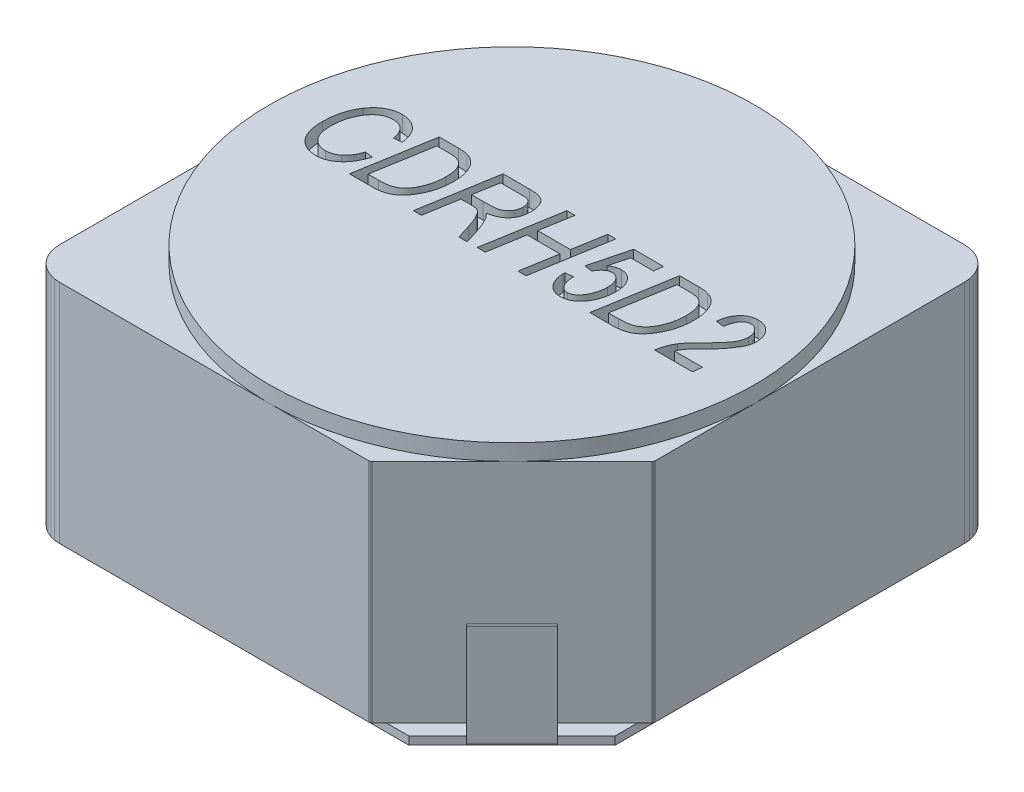
from build123d import *

# Parameters (mm, degrees)
EXTRUDE_1_DEPTH     = 0.1
EXTRUDE_1_2_DEPTH   = 0.1
EXTRUDE_2_DEPTH     = 2.8
EXTRUDE_3_DEPTH     = 1.2
FILLET_1_R          = 0.05
FILLET_2_R          = 0.05
SKETCH_5_R          = 3.000627
EXTRUDE_4_DEPTH     = 0.2
CUT_EXTRUDE_1_DEPTH = 0.2


with BuildPart() as part:
    # Эскиз2 → Бобышка-Вытянуть1 (new body)
    with BuildSketch(Plane(origin=(0, 0, 0), x_dir=(1, 0, 0), z_dir=(0, 1, 0))):
        Polygon((0.454807, -1.018854), (0.443746, -1.007793), (0.432957, -0.997004), (0.998007, -0.431953), (1.008796, -0.442742), (1.019858, -0.453804), (1.373411, -0.10025), (4.901254, -0.10025), (5.901254, -1.100251), (5.901254, -2.00025), (5.072486, -2.00025), (4.940356, -1.763366), (4.781258, -1.543684), (4.597404, -1.344259), (4.39135, -1.167866), (4.165964, -1.016958), (3.924379, -0.893632), (3.669955, -0.799606), (3.406231, -0.736185), (3.136875, -0.704253), (2.865633, -0.704253), (2.596277, -0.736185), (2.332552, -0.799606), (2.078129, -0.893632), (1.836544, -1.016958), (1.611158, -1.167866), (1.405104, -1.344259), (1.22125, -1.543684), (1.062152, -1.763366), (0.930023, -2.00025), (0.101254, -2.00025), (0.101254, -1.372408), align=None)
    extrude(amount=EXTRUDE_1_DEPTH)



with BuildPart() as body_2:
    # Эскиз2 → Extrude 1 2 (new body)
    with BuildSketch(Plane(origin=(0, 0, 0), x_dir=(1, 0, 0), z_dir=(0, 1, 0))):
        Polygon((1.611158, -4.832635), (1.836544, -4.983543), (2.078129, -5.106869), (2.332552, -5.200896), (2.596277, -5.264316), (2.865633, -5.296248), (3.136875, -5.296248), (3.406231, -5.264316), (3.669955, -5.200896), (3.924379, -5.106869), (4.165964, -4.983543), (4.39135, -4.832635), (4.597404, -4.656241), (4.781258, -4.456817), (4.940356, -4.237135), (5.072486, -4.00025), (5.901254, -4.00025), (5.901254, -4.628093), (5.5477, -4.981646), (5.558762, -4.992708), (5.569552, -5.003497), (5.004501, -5.568548), (4.993712, -5.557759), (4.98265, -5.546697), (4.629097, -5.90025), (1.101254, -5.90025), (0.101254, -4.900251), (0.101254, -4.00025), (0.930023, -4.00025), (1.062152, -4.237135), (1.22125, -4.456817), (1.405104, -4.656241), align=None)
    extrude(amount=EXTRUDE_1_2_DEPTH)


with BuildPart() as part_1:
    add(part.part)

    add(body_2.part)  # Бобышка-Вытянуть2 merges body 2
    # Эскиз3 → Бобышка-Вытянуть2 (add)
    with BuildSketch(Plane(origin=(0, 0.1, 0), x_dir=(1, 0, 0), z_dir=(0, 1, 0))):
        Polygon((0.101254, -1.655251), (1.656254, -0.10025), (1.741609, -0.014895), (1.747575, -0.0098), (1.754265, -0.0057), (1.761514, -0.002698), (1.769143, -0.000866), (1.776965, -0.000251), (5.601254, -0.000251), (5.663828, -0.005175), (5.724861, -0.019828), (5.78285, -0.043848), (5.836368, -0.076644), (5.884097, -0.117408), (5.924861, -0.165137), (5.957657, -0.218655), (5.981677, -0.276644), (5.996329, -0.337677), (6.001254, -0.400251), (6.001254, -4.22454), (6.000638, -4.232362), (5.998807, -4.239991), (5.995804, -4.24724), (5.991705, -4.253929), (5.986609, -4.259896), (5.901254, -4.345251), (4.346254, -5.90025), (4.260899, -5.985606), (4.254933, -5.990701), (4.248243, -5.994801), (4.240994, -5.997803), (4.233365, -5.999635), (4.225543, -6.000251), (0.401254, -6.000251), (0.33868, -5.995326), (0.277647, -5.980673), (0.219658, -5.956653), (0.16614, -5.923857), (0.118411, -5.883093), (0.077647, -5.835365), (0.044851, -5.781847), (0.020831, -5.723857), (0.006179, -5.662824), (0.001254, -5.600251), (0.001254, -1.775961), (0.00187, -1.76814), (0.003701, -1.76051), (0.006704, -1.753262), (0.010803, -1.746572), (0.015899, -1.740606), align=None)
    extrude(amount=EXTRUDE_2_DEPTH)

    # Эскиз4 → Бобышка-Вытянуть3 (add)
    with BuildSketch(Plane(origin=(0, 0.1, 0), x_dir=(1, 0, 0), z_dir=(0, 1, 0))):
        Polygon((0.454807, -1.018854), (1.019858, -0.453804), (0.998007, -0.431953), (0.432957, -0.997004), align=None)
        Polygon((4.98265, -5.546697), (5.5477, -4.981646), (5.569552, -5.003497), (5.004501, -5.568548), align=None)
    extrude(amount=EXTRUDE_3_DEPTH)

    # Скругление1
    fillet_1_edges = [part_1.edges().sort_by_distance(p)[0] for p in [
        (5.287026, 0, 5.286023),
    ]]
    fillet(fillet_1_edges, radius=FILLET_1_R)

    # Скругление2
    fillet_2_edges = [part_1.edges().sort_by_distance(p)[0] for p in [
        (0.715482, 0, 0.714478),
    ]]
    fillet(fillet_2_edges, radius=FILLET_2_R)

    # Эскиз5 → Бобышка-Вытянуть4 (add)
    with BuildSketch(Plane(origin=(0, 2.9, 0), x_dir=(1, 0, 0), z_dir=(0, 1, 0))):
        with Locations(Location((3.000627, -3.000126, 0), (0, 0, 88.717191))):
            Circle(SKETCH_5_R)
    extrude(amount=EXTRUDE_4_DEPTH)

    # Эскиз6 → Вырез-Вытянуть1 (cut)
    # profile 1 of 7: a face of its own
    with BuildSketch(Plane(origin=(0, 3.1, 0), x_dir=(1, 0, 0), z_dir=(0, 1, 0))):
        with BuildLine():
            Line((1.099199, -2.911531), (1.197901, -2.923868))
            add(Edge.make_bspline(
                [(1.197901, -2.923868), (1.193486, -2.937415), (1.18487, -2.963852), (1.16975, -3.001772), (1.153248, -3.037107), (1.13513, -3.069799), (1.115402, -3.099824), (1.094217, -3.127235), (1.071566, -3.15211), (1.047492, -3.174202), (1.022421, -3.193764), (0.996516, -3.210468), (0.970263, -3.224951), (0.943212, -3.23648), (0.915762, -3.245901), (0.887498, -3.252179), (0.858794, -3.256174), (0.839415, -3.256714), (0.829698, -3.256985)],
                knots=[0, 0, 0, 0, 1.281228, 2.500455, 3.669111, 4.786805, 5.85923, 6.897388, 7.899677, 8.881374, 9.832849, 10.756243, 11.651107, 12.526133, 13.397948, 14.257432, 15.12633, 16, 16, 16, 16], degree=3))
            add(Edge.make_bspline(
                [(0.829698, -3.256985), (0.817922, -3.256717), (0.794844, -3.256191), (0.761113, -3.251244), (0.729179, -3.243204), (0.698982, -3.231831), (0.670337, -3.217667), (0.643529, -3.199918), (0.618618, -3.178925), (0.595329, -3.155015), (0.574536, -3.127749), (0.556343, -3.097423), (0.540753, -3.064087), (0.528755, -3.027484), (0.518703, -2.98811), (0.51203, -2.945578), (0.507647, -2.900057), (0.507214, -2.868681), (0.506992, -2.852541)],
                knots=[0, 0, 0, 0, 0.965468, 1.891996, 2.789402, 3.661691, 4.533837, 5.405106, 6.291862, 7.201367, 8.137501, 9.097472, 10.097304, 11.149039, 12.252251, 13.427238, 14.676528, 16, 16, 16, 16], degree=3))
            add(Edge.make_bspline(
                [(0.506992, -2.852541), (0.507305, -2.833443), (0.507921, -2.795945), (0.51334, -2.740901), (0.521612, -2.688022), (0.53387, -2.637485), (0.549225, -2.589025), (0.568242, -2.542938), (0.590193, -2.498772), (0.607994, -2.471394), (0.616874, -2.457736)],
                knots=[0, 0, 0, 0, 1.101519, 2.162778, 3.187881, 4.186831, 5.159905, 6.117497, 7.06084, 8, 8, 8, 8], degree=3))
            add(Edge.make_bspline(
                [(0.616874, -2.457736), (0.621892, -2.450625), (0.631765, -2.436634), (0.647396, -2.41664), (0.663814, -2.398229), (0.680578, -2.380955), (0.697974, -2.365138), (0.715851, -2.3506), (0.73452, -2.337707), (0.753484, -2.325906), (0.773135, -2.315597), (0.79333, -2.306799), (0.814046, -2.299216), (0.835302, -2.29304), (0.857074, -2.28826), (0.879398, -2.284689), (0.90228, -2.282858), (0.91773, -2.282494), (0.925508, -2.28231)],
                knots=[0, 0, 0, 0, 1.12653, 2.216505, 3.28309, 4.318368, 5.331145, 6.324957, 7.298759, 8.266038, 9.214828, 10.168383, 11.115713, 12.06865, 13.03134, 13.999584, 14.992943, 16, 16, 16, 16], degree=3))
            add(Edge.make_bspline(
                [(0.925508, -2.28231), (0.935415, -2.282512), (0.954914, -2.282911), (0.983515, -2.286643), (1.010858, -2.29285), (1.036946, -2.301326), (1.061895, -2.31214), (1.085401, -2.325722), (1.107678, -2.341668), (1.128735, -2.359716), (1.147968, -2.380151), (1.165207, -2.40263), (1.180336, -2.427095), (1.193233, -2.453513), (1.203813, -2.481966), (1.212553, -2.512285), (1.218866, -2.544684), (1.221322, -2.567018), (1.222576, -2.578414)],
                knots=[0, 0, 0, 0, 1.020223, 2.007994, 2.965122, 3.905064, 4.829944, 5.761056, 6.696043, 7.648858, 8.613533, 9.581407, 10.562389, 11.571947, 12.604742, 13.6859, 14.819279, 16, 16, 16, 16], degree=3))
            Line((1.222576, -2.578414), (1.123875, -2.590752))
            add(Edge.make_bspline(
                [(1.123875, -2.590752), (1.122505, -2.582761), (1.119837, -2.567195), (1.114138, -2.544828), (1.107694, -2.523902), (1.099938, -2.504603), (1.09129, -2.486789), (1.081633, -2.470526), (1.071019, -2.455732), (1.059202, -2.442534), (1.046235, -2.430947), (1.032285, -2.42086), (1.017313, -2.412281), (1.001257, -2.405372), (0.984207, -2.399957), (0.966132, -2.396115), (0.947033, -2.39377), (0.933933, -2.393491), (0.927243, -2.393349)],
                knots=[0, 0, 0, 0, 1.260258, 2.455112, 3.586565, 4.662836, 5.68627, 6.663126, 7.600598, 8.513462, 9.412214, 10.299729, 11.18595, 12.09002, 13.012838, 13.963427, 14.959968, 16, 16, 16, 16], degree=3))
            add(Edge.make_bspline(
                [(0.927243, -2.393349), (0.91552, -2.393746), (0.892474, -2.394527), (0.858763, -2.401013), (0.8269, -2.412018), (0.79651, -2.426815), (0.768191, -2.446512), (0.741439, -2.470106), (0.71672, -2.498257), (0.69386, -2.530025), (0.673254, -2.564743), (0.655118, -2.601341), (0.63983, -2.63958), (0.627267, -2.679323), (0.61768, -2.720723), (0.61078, -2.76368), (0.606395, -2.808176), (0.605929, -2.838394), (0.605693, -2.853698)],
                knots=[0, 0, 0, 0, 0.903137, 1.775501, 2.633887, 3.495597, 4.372141, 5.284508, 6.238829, 7.253412, 8.297421, 9.347418, 10.398745, 11.468705, 12.55725, 13.671237, 14.820616, 16, 16, 16, 16], degree=3))
            add(Edge.make_bspline(
                [(0.605693, -2.853698), (0.605853, -2.8654), (0.606164, -2.888141), (0.609281, -2.921195), (0.614427, -2.951995), (0.621497, -2.98061), (0.630802, -3.006915), (0.641898, -3.031174), (0.655253, -3.053141), (0.670735, -3.072637), (0.68781, -3.089716), (0.705671, -3.104989), (0.725015, -3.11752), (0.745215, -3.128064), (0.766703, -3.135939), (0.789156, -3.141767), (0.812751, -3.145302), (0.828851, -3.145729), (0.837024, -3.145946)],
                knots=[0, 0, 0, 0, 1.335276, 2.594853, 3.78487, 4.896581, 5.954293, 6.964911, 7.935927, 8.880865, 9.798777, 10.688964, 11.55753, 12.42346, 13.284406, 14.16313, 15.067554, 16, 16, 16, 16], degree=3))
            add(Edge.make_bspline(
                [(0.837024, -3.145946), (0.844103, -3.145841), (0.858059, -3.145632), (0.878602, -3.142702), (0.898566, -3.138578), (0.917811, -3.132511), (0.936513, -3.125092), (0.954226, -3.115429), (0.971563, -3.104518), (0.982325, -3.095931), (0.987775, -3.091584)],
                knots=[0, 0, 0, 0, 1.037246, 2.044789, 3.03728, 4.023849, 5.000285, 5.982523, 6.978454, 8, 8, 8, 8], degree=3))
            add(Edge.make_bspline(
                [(0.987775, -3.091584), (0.994228, -3.085832), (1.007131, -3.07433), (1.024843, -3.055356), (1.041149, -3.035038), (1.055842, -3.013171), (1.068889, -2.989756), (1.08068, -2.965062), (1.091016, -2.938931), (1.096442, -2.920765), (1.099199, -2.911531)],
                knots=[0, 0, 0, 0, 0.964744, 1.929115, 2.893833, 3.87085, 4.866654, 5.883935, 6.924454, 8, 8, 8, 8], degree=3))
        make_face()
    # profile 2 of 7: a face of its own
    with BuildSketch(Plane(origin=(0, 3.1, 0), x_dir=(1, 0, 0), z_dir=(0, 1, 0))):
        with BuildLine():
            Line((1.234914, -3.244648), (1.395496, -2.294648))
            Line((1.395496, -2.294648), (1.632225, -2.294648))
            add(Edge.make_bspline(
                [(1.632225, -2.294648), (1.644697, -2.29477), (1.668122, -2.295), (1.700872, -2.29732), (1.728993, -2.300773), (1.745799, -2.305036), (1.753481, -2.306985)],
                knots=[0, 0, 0, 0, 1.224118, 2.29924, 3.22264, 4, 4, 4, 4], degree=3))
            add(Edge.make_bspline(
                [(1.753481, -2.306985), (1.763552, -2.310241), (1.783674, -2.316747), (1.812001, -2.331573), (1.838619, -2.350024), (1.86333, -2.372331), (1.886079, -2.398349), (1.90625, -2.42839), (1.923087, -2.46276), (1.937421, -2.500653), (1.949076, -2.541964), (1.956893, -2.586532), (1.962129, -2.634001), (1.962596, -2.66669), (1.962836, -2.683477)],
                knots=[0, 0, 0, 0, 0.820956, 1.640257, 2.472426, 3.331337, 4.219288, 5.151, 6.133209, 7.185399, 8.294784, 9.461828, 10.696591, 12, 12, 12, 12], degree=3))
            add(Edge.make_bspline(
                [(1.962836, -2.683477), (1.962763, -2.694855), (1.962618, -2.717374), (1.960319, -2.750676), (1.957125, -2.783228), (1.952518, -2.814946), (1.946532, -2.845888), (1.939204, -2.875997), (1.930546, -2.905345), (1.917295, -2.942791), (1.898766, -2.986862), (1.874006, -3.036028), (1.846338, -3.080124), (1.821129, -3.113405), (1.799387, -3.137085), (1.782925, -3.153593), (1.765473, -3.168391), (1.747503, -3.181987), (1.728847, -3.194152), (1.709372, -3.204735), (1.689449, -3.214325), (1.675582, -3.219378), (1.66866, -3.2219)],
                knots=[0, 0, 0, 0, 1.049087, 2.076389, 3.077074, 4.065186, 5.031011, 5.982529, 6.921958, 7.851596, 9.644503, 11.32748, 12.922419, 14.439629, 15.169538, 15.886118, 16.58804, 17.277851, 17.963294, 18.639633, 19.32094, 20, 20, 20, 20], degree=3))
            add(Edge.make_bspline(
                [(1.66866, -3.2219), (1.65761, -3.225504), (1.634731, -3.232965), (1.597836, -3.239322), (1.558068, -3.244093), (1.530456, -3.244459), (1.516174, -3.244648)],
                knots=[0, 0, 0, 0, 0.899389, 1.862179, 2.894171, 4, 4, 4, 4], degree=3))
            Line((1.516174, -3.244648), (1.234914, -3.244648))
        make_face()
        with BuildLine():
            Line((1.353664, -3.133609), (1.48051, -3.133609))
            add(Edge.make_bspline(
                [(1.48051, -3.133609), (1.494784, -3.133412), (1.522221, -3.133035), (1.561684, -3.129462), (1.597884, -3.124077), (1.631181, -3.116056), (1.662108, -3.104628), (1.690987, -3.088761), (1.718071, -3.068436), (1.743807, -3.043928), (1.767665, -3.014339), (1.789833, -2.979602), (1.810045, -2.939431), (1.828957, -2.894638), (1.844732, -2.845366), (1.85602, -2.792299), (1.86284, -2.735961), (1.863696, -2.697312), (1.864134, -2.677501)],
                knots=[0, 0, 0, 0, 1.006689, 1.93501, 2.792811, 3.586587, 4.346859, 5.111644, 5.902205, 6.729396, 7.612223, 8.576651, 9.63085, 10.780834, 12.003673, 13.274178, 14.602782, 16, 16, 16, 16], degree=3))
            add(Edge.make_bspline(
                [(1.864134, -2.677501), (1.863993, -2.668761), (1.863717, -2.651784), (1.862469, -2.626941), (1.85992, -2.603534), (1.856573, -2.581423), (1.851812, -2.56082), (1.846616, -2.541468), (1.839932, -2.523608), (1.832442, -2.507066), (1.824196, -2.49171), (1.814907, -2.477861), (1.804986, -2.465294), (1.794707, -2.453693), (1.783076, -2.444002), (1.771272, -2.434939), (1.758364, -2.427595), (1.749341, -2.423663), (1.744806, -2.421687)],
                knots=[0, 0, 0, 0, 1.399036, 2.717422, 3.979237, 5.166198, 6.293984, 7.361992, 8.370714, 9.341881, 10.266916, 11.15687, 12.006573, 12.829142, 13.631203, 14.425179, 15.208426, 16, 16, 16, 16], degree=3))
            add(Edge.make_bspline(
                [(1.744806, -2.421687), (1.741289, -2.420411), (1.733828, -2.417706), (1.721736, -2.414611), (1.708345, -2.411548), (1.693426, -2.409618), (1.677102, -2.407876), (1.659361, -2.406512), (1.640264, -2.405748), (1.627085, -2.405708), (1.620273, -2.405687)],
                knots=[0, 0, 0, 0, 0.711076, 1.508474, 2.37135, 3.321846, 4.366355, 5.493848, 6.704619, 8, 8, 8, 8], degree=3))
            Line((1.620273, -2.405687), (1.476655, -2.405687))
            Line((1.476655, -2.405687), (1.353664, -3.133609))
        make_face(mode=Mode.SUBTRACT)
    # profile 3 of 7: a face of its own
    with BuildSketch(Plane(origin=(0, 3.1, 0), x_dir=(1, 0, 0), z_dir=(0, 1, 0))):
        with BuildLine():
            Line((2.024524, -3.244648), (2.185106, -2.294648))
            Line((2.185106, -2.294648), (2.511476, -2.294648))
            add(Edge.make_bspline(
                [(2.511476, -2.294648), (2.520022, -2.294745), (2.536478, -2.294931), (2.560225, -2.295708), (2.582051, -2.297857), (2.602174, -2.299906), (2.620362, -2.303252), (2.636746, -2.307042), (2.651282, -2.31162), (2.667984, -2.318728), (2.686429, -2.329384), (2.705576, -2.344977), (2.721805, -2.363273), (2.729747, -2.377378), (2.733747, -2.384481)],
                knots=[0, 0, 0, 0, 1.2119, 2.333478, 3.367045, 4.320875, 5.200169, 5.986887, 6.704345, 7.357547, 8.557712, 9.710316, 10.84682, 12, 12, 12, 12], degree=3))
            add(Edge.make_bspline(
                [(2.733747, -2.384481), (2.738531, -2.394781), (2.748334, -2.415888), (2.75787, -2.450466), (2.763777, -2.487796), (2.764441, -2.513617), (2.764784, -2.526943)],
                knots=[0, 0, 0, 0, 0.924918, 1.895357, 2.913843, 4, 4, 4, 4], degree=3))
            add(Edge.make_bspline(
                [(2.764784, -2.526943), (2.76462, -2.537039), (2.7643, -2.556768), (2.76119, -2.58553), (2.755945, -2.61272), (2.74886, -2.638336), (2.739909, -2.662483), (2.728295, -2.684745), (2.71509, -2.705637), (2.699692, -2.724883), (2.682304, -2.742529), (2.66266, -2.758316), (2.641141, -2.772695), (2.61753, -2.785341), (2.591987, -2.796624), (2.564268, -2.805958), (2.534584, -2.813912), (2.513948, -2.817786), (2.503379, -2.819769)],
                knots=[0, 0, 0, 0, 1.113824, 2.176432, 3.18744, 4.166334, 5.106638, 6.023139, 6.9319, 7.830003, 8.737546, 9.660035, 10.60599, 11.589547, 12.611905, 13.68377, 14.813795, 16, 16, 16, 16], degree=3))
            add(Edge.make_bspline(
                [(2.503379, -2.819769), (2.509829, -2.826175), (2.522458, -2.838717), (2.539516, -2.858566), (2.554082, -2.879084), (2.562223, -2.893341), (2.566224, -2.90035)],
                knots=[0, 0, 0, 0, 1.062791, 2.080832, 3.056614, 4, 4, 4, 4], degree=3))
            add(Edge.make_bspline(
                [(2.566224, -2.90035), (2.573227, -2.913975), (2.587119, -2.941008), (2.605628, -2.982447), (2.622089, -3.024182), (2.631388, -3.052467), (2.636009, -3.066523)],
                knots=[0, 0, 0, 0, 1.018456, 2.020596, 3.016357, 4, 4, 4, 4], degree=3))
            Line((2.636009, -3.066523), (2.691336, -3.244648))
            Line((2.691336, -3.244648), (2.588586, -3.244648))
            Line((2.588586, -3.244648), (2.533067, -3.067101))
            add(Edge.make_bspline(
                [(2.533067, -3.067101), (2.52777, -3.050721), (2.517571, -3.019181), (2.500188, -2.974563), (2.48191, -2.93427), (2.468013, -2.909644), (2.461354, -2.897844)],
                knots=[0, 0, 0, 0, 1.121138, 2.158847, 3.117745, 4, 4, 4, 4], degree=3))
            add(Edge.make_bspline(
                [(2.461354, -2.897844), (2.457216, -2.891044), (2.449442, -2.878271), (2.435945, -2.861952), (2.422511, -2.848871), (2.407854, -2.83916), (2.390695, -2.832629), (2.370116, -2.828212), (2.345237, -2.825665), (2.327253, -2.825342), (2.317543, -2.825167)],
                knots=[0, 0, 0, 0, 1.108967, 2.083407, 2.945817, 3.716564, 4.517225, 5.49146, 6.645694, 8, 8, 8, 8], degree=3))
            Line((2.317543, -2.825167), (2.195323, -2.825167))
            Line((2.195323, -2.825167), (2.124575, -3.244648))
            Line((2.124575, -3.244648), (2.024524, -3.244648))
        make_face()
        with BuildLine():
            Line((2.214216, -2.714128), (2.358026, -2.714128))
            add(Edge.make_bspline(
                [(2.358026, -2.714128), (2.367601, -2.714081), (2.38598, -2.713992), (2.412327, -2.713586), (2.436302, -2.713096), (2.457893, -2.712093), (2.477108, -2.710949), (2.493903, -2.709711), (2.508232, -2.707938), (2.524027, -2.705493), (2.541658, -2.70109), (2.561219, -2.693707), (2.579536, -2.684453), (2.596289, -2.673011), (2.611622, -2.659828), (2.625402, -2.644932), (2.637355, -2.628247), (2.647582, -2.610092), (2.655931, -2.590608), (2.661884, -2.569962), (2.665451, -2.548272), (2.665869, -2.533511), (2.666082, -2.525979)],
                knots=[0, 0, 0, 0, 1.38572, 2.659946, 3.813474, 4.856103, 5.787768, 6.599477, 7.292742, 7.87679, 8.912093, 9.915667, 10.897239, 11.874837, 12.844218, 13.818271, 14.804239, 15.807813, 16.828689, 17.864702, 18.910479, 20, 20, 20, 20], degree=3))
            add(Edge.make_bspline(
                [(2.666082, -2.525979), (2.665929, -2.519282), (2.665631, -2.506326), (2.662481, -2.487816), (2.657545, -2.470885), (2.650323, -2.455959), (2.641971, -2.442756), (2.632201, -2.431823), (2.621497, -2.423), (2.609215, -2.41593), (2.59387, -2.411151), (2.574644, -2.407852), (2.550767, -2.40615), (2.533326, -2.40585), (2.523814, -2.405687)],
                knots=[0, 0, 0, 0, 1.110759, 2.149019, 3.107483, 4.028465, 4.892511, 5.693398, 6.451505, 7.187215, 8.030598, 9.104051, 10.420551, 12, 12, 12, 12], degree=3))
            Line((2.523814, -2.405687), (2.266265, -2.405687))
            Line((2.266265, -2.405687), (2.214216, -2.714128))
        make_face(mode=Mode.SUBTRACT)
    # profile 4 of 7: a face of its own
    with BuildSketch(Plane(origin=(0, 3.1, 0), x_dir=(1, 0, 0), z_dir=(0, 1, 0))):
        Polygon((2.814134, -3.244648), (2.974717, -2.294648), (3.074575, -2.294648), (3.007874, -2.689453), (3.41386, -2.689453), (3.480561, -2.294648), (3.580419, -2.294648), (3.420029, -3.244648), (3.319979, -3.244648), (3.395161, -2.800492), (2.989175, -2.800492), (2.913992, -3.244648), align=None)
    # profile 5 of 7: a face of its own
    with BuildSketch(Plane(origin=(0, 3.1, 0), x_dir=(1, 0, 0), z_dir=(0, 1, 0))):
        with BuildLine():
            Line((3.62842, -2.973219), (3.727121, -2.960881))
            Line((3.727121, -2.960881), (3.725772, -2.991918))
            add(Edge.make_bspline(
                [(3.725772, -2.991918), (3.725978, -2.9999), (3.726388, -3.015757), (3.730177, -3.039231), (3.736446, -3.062118), (3.744751, -3.084177), (3.754993, -3.104519), (3.766583, -3.122525), (3.779431, -3.137646), (3.79352, -3.149814), (3.808435, -3.159149), (3.823926, -3.165737), (3.83988, -3.169819), (3.850667, -3.170353), (3.856089, -3.170622)],
                knots=[0, 0, 0, 0, 1.176851, 2.337943, 3.496943, 4.673031, 5.809205, 6.850413, 7.825158, 8.725874, 9.586018, 10.410038, 11.20095, 12, 12, 12, 12], degree=3))
            add(Edge.make_bspline(
                [(3.856089, -3.170622), (3.862949, -3.17013), (3.877173, -3.169112), (3.898483, -3.161855), (3.920053, -3.15021), (3.941771, -3.13405), (3.963399, -3.113473), (3.982814, -3.087206), (4.001076, -3.056427), (4.017232, -3.021341), (4.030742, -2.983419), (4.040589, -2.944047), (4.046856, -2.903957), (4.047551, -2.876918), (4.047901, -2.863337)],
                knots=[0, 0, 0, 0, 0.627637, 1.301192, 2.040786, 2.865698, 3.772792, 4.763603, 5.845276, 7.045587, 8.29424, 9.525711, 10.757183, 12, 12, 12, 12], degree=3))
            add(Edge.make_bspline(
                [(4.047901, -2.863337), (4.047796, -2.856265), (4.047591, -2.842483), (4.045829, -2.822393), (4.042975, -2.803451), (4.038967, -2.785716), (4.03376, -2.769107), (4.027206, -2.753792), (4.019673, -2.73955), (4.011016, -2.726625), (4.001401, -2.715174), (3.991286, -2.704954), (3.980555, -2.696247), (3.969008, -2.689196), (3.956862, -2.683837), (3.94413, -2.679898), (3.93078, -2.677546), (3.921642, -2.67726), (3.917006, -2.677115)],
                knots=[0, 0, 0, 0, 1.334622, 2.600692, 3.80312, 4.947634, 6.02931, 7.083576, 8.087382, 9.066259, 10.013519, 10.905432, 11.776739, 12.615005, 13.451163, 14.275985, 15.125407, 16, 16, 16, 16], degree=3))
            add(Edge.make_bspline(
                [(3.917006, -2.677115), (3.910479, -2.677444), (3.89741, -2.678102), (3.878185, -2.683674), (3.859529, -2.692379), (3.841621, -2.704896), (3.824217, -2.720638), (3.80747, -2.739938), (3.791212, -2.762597), (3.781529, -2.779386), (3.776472, -2.788154)],
                knots=[0, 0, 0, 0, 0.832067, 1.666195, 2.536201, 3.451172, 4.444748, 5.526231, 6.708118, 8, 8, 8, 8], degree=3))
            Line((3.776472, -2.788154), (3.677771, -2.775816))
            Line((3.677771, -2.775816), (3.801147, -2.294648))
            Line((3.801147, -2.294648), (4.171277, -2.294648))
            Line((4.171277, -2.294648), (4.155855, -2.405687))
            Line((4.155855, -2.405687), (3.874209, -2.405687))
            Line((3.874209, -2.405687), (3.814642, -2.637403))
            add(Edge.make_bspline(
                [(3.814642, -2.637403), (3.819921, -2.633659), (3.830298, -2.626298), (3.846556, -2.616827), (3.863121, -2.608941), (3.879758, -2.602039), (3.896867, -2.597137), (3.914105, -2.593357), (3.931669, -2.591252), (3.943475, -2.590919), (3.949392, -2.590752)],
                knots=[0, 0, 0, 0, 1.070294, 2.104015, 3.107171, 4.103999, 5.079399, 6.046773, 7.02113, 8, 8, 8, 8], degree=3))
            add(Edge.make_bspline(
                [(3.949392, -2.590752), (3.956217, -2.590981), (3.969625, -2.59143), (3.989375, -2.594802), (4.008259, -2.600393), (4.026326, -2.608142), (4.043497, -2.618163), (4.059938, -2.630291), (4.075333, -2.644952), (4.089993, -2.661423), (4.103278, -2.680032), (4.115202, -2.700434), (4.124573, -2.722995), (4.132951, -2.747054), (4.138795, -2.773088), (4.143661, -2.800783), (4.145955, -2.830398), (4.146382, -2.85074), (4.146602, -2.861216)],
                knots=[0, 0, 0, 0, 0.874681, 1.718475, 2.560458, 3.394504, 4.232446, 5.104095, 6.007519, 6.953048, 7.927041, 8.934602, 9.975267, 11.053852, 12.19687, 13.391455, 14.65649, 16, 16, 16, 16], degree=3))
            add(Edge.make_bspline(
                [(4.146602, -2.861216), (4.146307, -2.875751), (4.14573, -2.904248), (4.141146, -2.946059), (4.134018, -2.986019), (4.123444, -3.024018), (4.110304, -3.060196), (4.093663, -3.094274), (4.074542, -3.126704), (4.059351, -3.146601), (4.051756, -3.156549)],
                knots=[0, 0, 0, 0, 1.102348, 2.161213, 3.187115, 4.178133, 5.149756, 6.102499, 7.051343, 8, 8, 8, 8], degree=3))
            add(Edge.make_bspline(
                [(4.051756, -3.156549), (4.044976, -3.164536), (4.031688, -3.18019), (4.009401, -3.200742), (3.985707, -3.217883), (3.961132, -3.232438), (3.935074, -3.243526), (3.907696, -3.251083), (3.879219, -3.256202), (3.859774, -3.256722), (3.84992, -3.256985)],
                knots=[0, 0, 0, 0, 1.075626, 2.108107, 3.105028, 4.075364, 5.036676, 6.004224, 6.988585, 8, 8, 8, 8], degree=3))
            add(Edge.make_bspline(
                [(3.84992, -3.256985), (3.839869, -3.256622), (3.82011, -3.255908), (3.791278, -3.250048), (3.764205, -3.239949), (3.73853, -3.226574), (3.714995, -3.20871), (3.693613, -3.186903), (3.674723, -3.160876), (3.658045, -3.131461), (3.6448, -3.099088), (3.634828, -3.065011), (3.628928, -3.029458), (3.628207, -3.005306), (3.627842, -2.993075)],
                knots=[0, 0, 0, 0, 0.939265, 1.846623, 2.736261, 3.634018, 4.543721, 5.486975, 6.479631, 7.542405, 8.641519, 9.742536, 10.856786, 12, 12, 12, 12], degree=3))
            Line((3.627842, -2.993075), (3.62842, -2.973219))
        make_face()
    # profile 6 of 7: a face of its own
    with BuildSketch(Plane(origin=(0, 3.1, 0), x_dir=(1, 0, 0), z_dir=(0, 1, 0))):
        with BuildLine():
            Line((4.20829, -3.244648), (4.368873, -2.294648))
            Line((4.368873, -2.294648), (4.605601, -2.294648))
            add(Edge.make_bspline(
                [(4.605601, -2.294648), (4.618073, -2.29477), (4.641499, -2.295), (4.674248, -2.29732), (4.70237, -2.300773), (4.719176, -2.305036), (4.726858, -2.306985)],
                knots=[0, 0, 0, 0, 1.224118, 2.29924, 3.22264, 4, 4, 4, 4], degree=3))
            add(Edge.make_bspline(
                [(4.726858, -2.306985), (4.736929, -2.310241), (4.75705, -2.316747), (4.785378, -2.331573), (4.811995, -2.350024), (4.836707, -2.372331), (4.859456, -2.398349), (4.879626, -2.42839), (4.896464, -2.46276), (4.910797, -2.500653), (4.922453, -2.541964), (4.93027, -2.586532), (4.935505, -2.634001), (4.935972, -2.66669), (4.936212, -2.683477)],
                knots=[0, 0, 0, 0, 0.820956, 1.640257, 2.472426, 3.331337, 4.219288, 5.151, 6.133209, 7.185399, 8.294784, 9.461828, 10.696591, 12, 12, 12, 12], degree=3))
            add(Edge.make_bspline(
                [(4.936212, -2.683477), (4.936139, -2.694855), (4.935995, -2.717374), (4.933696, -2.750676), (4.930501, -2.783228), (4.925895, -2.814946), (4.919909, -2.845888), (4.912581, -2.875997), (4.903922, -2.905345), (4.890672, -2.942791), (4.872142, -2.986862), (4.847382, -3.036028), (4.819714, -3.080124), (4.794505, -3.113405), (4.772763, -3.137085), (4.756302, -3.153593), (4.738849, -3.168391), (4.72088, -3.181987), (4.702224, -3.194152), (4.682749, -3.204735), (4.662826, -3.214325), (4.648958, -3.219378), (4.642036, -3.2219)],
                knots=[0, 0, 0, 0, 1.049087, 2.076389, 3.077074, 4.065186, 5.031011, 5.982529, 6.921958, 7.851596, 9.644503, 11.32748, 12.922419, 14.439629, 15.169538, 15.886118, 16.58804, 17.277851, 17.963294, 18.639633, 19.32094, 20, 20, 20, 20], degree=3))
            add(Edge.make_bspline(
                [(4.642036, -3.2219), (4.630986, -3.225504), (4.608108, -3.232965), (4.571212, -3.239322), (4.531444, -3.244093), (4.503833, -3.244459), (4.48955, -3.244648)],
                knots=[0, 0, 0, 0, 0.899389, 1.862179, 2.894171, 4, 4, 4, 4], degree=3))
            Line((4.48955, -3.244648), (4.20829, -3.244648))
        make_face()
        with BuildLine():
            Line((4.32704, -3.133609), (4.453887, -3.133609))
            add(Edge.make_bspline(
                [(4.453887, -3.133609), (4.468161, -3.133412), (4.495598, -3.133035), (4.53506, -3.129462), (4.571261, -3.124077), (4.604558, -3.116056), (4.635485, -3.104628), (4.664363, -3.088761), (4.691448, -3.068436), (4.717183, -3.043928), (4.741042, -3.014339), (4.76321, -2.979602), (4.783422, -2.939431), (4.802334, -2.894638), (4.818109, -2.845366), (4.829396, -2.792299), (4.836217, -2.735961), (4.837072, -2.697312), (4.837511, -2.677501)],
                knots=[0, 0, 0, 0, 1.006689, 1.93501, 2.792811, 3.586587, 4.346859, 5.111644, 5.902205, 6.729396, 7.612223, 8.576651, 9.63085, 10.780834, 12.003673, 13.274178, 14.602782, 16, 16, 16, 16], degree=3))
            add(Edge.make_bspline(
                [(4.837511, -2.677501), (4.837369, -2.668761), (4.837094, -2.651784), (4.835846, -2.626941), (4.833296, -2.603534), (4.82995, -2.581423), (4.825189, -2.56082), (4.819993, -2.541468), (4.813309, -2.523608), (4.805819, -2.507066), (4.797573, -2.49171), (4.788283, -2.477861), (4.778363, -2.465294), (4.768084, -2.453693), (4.756452, -2.444002), (4.744648, -2.434939), (4.731741, -2.427595), (4.722718, -2.423663), (4.718183, -2.421687)],
                knots=[0, 0, 0, 0, 1.399036, 2.717422, 3.979237, 5.166198, 6.293984, 7.361992, 8.370714, 9.341881, 10.266916, 11.15687, 12.006573, 12.829142, 13.631203, 14.425179, 15.208426, 16, 16, 16, 16], degree=3))
            add(Edge.make_bspline(
                [(4.718183, -2.421687), (4.714665, -2.420411), (4.707204, -2.417706), (4.695113, -2.414611), (4.681722, -2.411548), (4.666802, -2.409618), (4.650478, -2.407876), (4.632738, -2.406512), (4.613641, -2.405748), (4.600462, -2.405708), (4.593649, -2.405687)],
                knots=[0, 0, 0, 0, 0.711076, 1.508474, 2.37135, 3.321846, 4.366355, 5.493848, 6.704619, 8, 8, 8, 8], degree=3))
            Line((4.593649, -2.405687), (4.450031, -2.405687))
            Line((4.450031, -2.405687), (4.32704, -3.133609))
        make_face(mode=Mode.SUBTRACT)
    # profile 7 of 7: a face of its own
    with BuildSketch(Plane(origin=(0, 3.1, 0), x_dir=(1, 0, 0), z_dir=(0, 1, 0))):
        with BuildLine():
            add(Edge.make_bspline(
                [(5.010238, -3.244648), (5.012064, -3.23441), (5.015652, -3.214288), (5.022684, -3.184987), (5.030594, -3.156947), (5.039385, -3.130132), (5.049391, -3.104625), (5.060677, -3.080502), (5.072682, -3.057498), (5.08173, -3.043014), (5.086192, -3.035871)],
                knots=[0, 0, 0, 0, 1.11546, 2.192311, 3.231109, 4.240461, 5.218511, 6.168485, 7.096724, 8, 8, 8, 8], degree=3))
            add(Edge.make_bspline(
                [(5.086192, -3.035871), (5.090195, -3.030119), (5.099117, -3.017298), (5.114968, -2.996939), (5.134826, -2.97363), (5.158242, -2.947111), (5.185606, -2.917589), (5.216524, -2.884826), (5.251566, -2.849237), (5.276133, -2.824453), (5.288992, -2.81148)],
                knots=[0, 0, 0, 0, 0.555346, 1.237883, 2.04388, 2.981986, 4.041647, 5.234114, 6.552264, 8, 8, 8, 8], degree=3))
            add(Edge.make_bspline(
                [(5.288992, -2.81148), (5.296592, -2.803529), (5.311261, -2.788181), (5.332259, -2.765648), (5.350976, -2.743914), (5.368545, -2.723882), (5.383692, -2.704479), (5.3972, -2.68647), (5.408901, -2.669593), (5.421856, -2.648839), (5.43513, -2.623274), (5.445992, -2.591816), (5.45329, -2.560049), (5.454026, -2.538613), (5.454394, -2.527907)],
                knots=[0, 0, 0, 0, 1.175324, 2.268622, 3.290481, 4.240045, 5.11509, 5.919827, 6.645483, 7.308536, 8.533783, 9.712972, 10.857692, 12, 12, 12, 12], degree=3))
            add(Edge.make_bspline(
                [(5.454394, -2.527907), (5.453985, -2.516815), (5.453196, -2.495424), (5.446149, -2.464846), (5.434331, -2.43733), (5.420369, -2.417391), (5.40792, -2.403138), (5.397735, -2.394092), (5.387442, -2.386167), (5.376664, -2.379563), (5.365287, -2.374882), (5.353612, -2.371335), (5.341509, -2.369138), (5.333276, -2.36883), (5.32909, -2.368674)],
                knots=[0, 0, 0, 0, 1.774345, 3.421926, 4.993478, 6.540581, 7.298627, 8.019948, 8.717686, 9.377752, 10.037176, 10.68182, 11.329823, 12, 12, 12, 12], degree=3))
            add(Edge.make_bspline(
                [(5.32909, -2.368674), (5.324841, -2.368837), (5.316419, -2.36916), (5.303967, -2.371298), (5.292024, -2.375009), (5.280366, -2.380057), (5.269358, -2.386935), (5.258388, -2.394759), (5.248165, -2.404453), (5.238119, -2.415372), (5.228626, -2.427981), (5.2199, -2.442375), (5.212118, -2.458656), (5.204747, -2.476582), (5.198258, -2.496394), (5.192295, -2.517932), (5.187062, -2.54135), (5.184363, -2.557643), (5.182966, -2.566076)],
                knots=[0, 0, 0, 0, 0.761372, 1.509125, 2.255814, 2.998228, 3.778266, 4.577447, 5.408589, 6.297022, 7.23433, 8.231608, 9.307918, 10.464741, 11.702783, 13.04093, 14.468488, 16, 16, 16, 16], degree=3))
            Line((5.182966, -2.566076), (5.084264, -2.553739))
            add(Edge.make_bspline(
                [(5.084264, -2.553739), (5.085611, -2.543179), (5.088244, -2.522541), (5.094295, -2.49268), (5.101616, -2.464549), (5.111237, -2.438565), (5.121911, -2.414161), (5.134708, -2.391839), (5.148972, -2.371271), (5.164853, -2.352731), (5.181914, -2.33615), (5.200141, -2.321851), (5.219105, -2.309629), (5.238872, -2.299466), (5.259641, -2.291702), (5.281327, -2.286392), (5.303857, -2.282981), (5.319181, -2.282536), (5.326969, -2.28231)],
                knots=[0, 0, 0, 0, 1.270305, 2.482808, 3.634587, 4.736233, 5.786894, 6.810637, 7.802265, 8.770718, 9.720057, 10.637724, 11.531384, 12.409603, 13.285843, 14.171401, 15.070706, 16, 16, 16, 16], degree=3))
            add(Edge.make_bspline(
                [(5.326969, -2.28231), (5.335463, -2.282533), (5.352066, -2.28297), (5.376269, -2.286342), (5.399131, -2.29161), (5.420593, -2.299438), (5.440602, -2.309465), (5.45938, -2.321573), (5.476823, -2.335832), (5.492459, -2.352504), (5.50668, -2.370487), (5.519079, -2.389751), (5.529775, -2.409938), (5.538198, -2.431393), (5.545071, -2.45372), (5.549541, -2.477261), (5.552581, -2.501738), (5.552922, -2.518451), (5.553095, -2.526943)],
                knots=[0, 0, 0, 0, 1.088923, 2.128518, 3.127947, 4.09252, 5.050735, 5.992509, 6.952707, 7.931954, 8.917836, 9.889319, 10.866136, 11.842466, 12.840976, 13.857551, 14.911421, 16, 16, 16, 16], degree=3))
            add(Edge.make_bspline(
                [(5.553095, -2.526943), (5.552905, -2.534597), (5.552525, -2.549897), (5.5496, -2.572693), (5.5445, -2.595175), (5.537532, -2.617415), (5.528646, -2.639401), (5.51782, -2.661099), (5.504821, -2.682375), (5.494909, -2.696009), (5.489865, -2.702947)],
                knots=[0, 0, 0, 0, 0.96457, 1.927882, 2.890614, 3.866507, 4.862061, 5.876152, 6.919224, 8, 8, 8, 8], degree=3))
            add(Edge.make_bspline(
                [(5.489865, -2.702947), (5.486557, -2.709365), (5.479303, -2.72344), (5.465082, -2.745197), (5.447343, -2.769788), (5.425742, -2.797211), (5.400563, -2.827622), (5.371317, -2.860743), (5.338417, -2.896738), (5.314934, -2.921405), (5.302679, -2.934278)],
                knots=[0, 0, 0, 0, 0.580235, 1.272569, 2.087071, 3.018368, 4.078882, 5.261516, 6.570842, 8, 8, 8, 8], degree=3))
            add(Edge.make_bspline(
                [(5.302679, -2.934278), (5.292442, -2.943247), (5.272702, -2.960541), (5.245431, -2.987116), (5.221073, -3.012876), (5.199729, -3.038053), (5.181812, -3.062853), (5.166551, -3.086695), (5.154583, -3.110145), (5.148764, -3.125966), (5.145953, -3.133609)],
                knots=[0, 0, 0, 0, 1.27357, 2.455906, 3.562096, 4.590848, 5.542377, 6.423387, 7.238328, 8, 8, 8, 8], degree=3))
            Line((5.145953, -3.133609), (5.491407, -3.133609))
            Line((5.491407, -3.133609), (5.479069, -3.244648))
            Line((5.479069, -3.244648), (5.010238, -3.244648))
        make_face()
    extrude(amount=-CUT_EXTRUDE_1_DEPTH, mode=Mode.SUBTRACT)


solid = part_1.part
